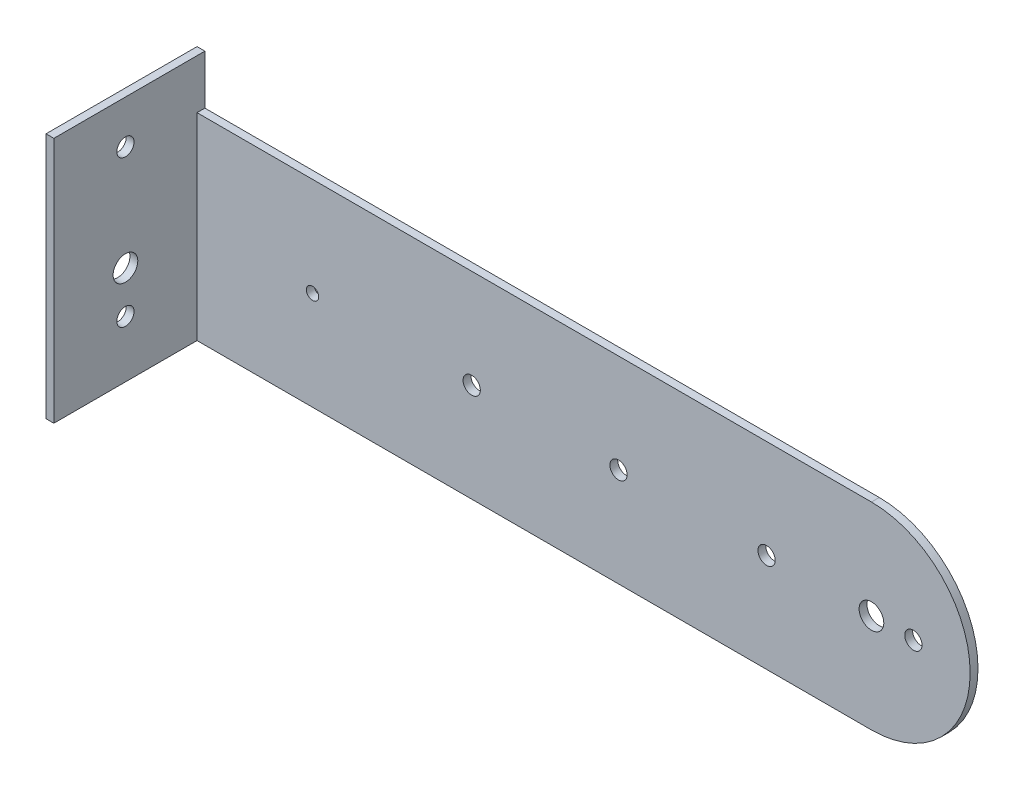
from build123d import *

# Parameters (mm, degrees)
BOSS_EXTRUDE1_DEPTH = 1.59
SKETCH2_R           = 2.5
SKETCH2_R_2         = 1.75
CUT_EXTRUDE2_DEPTH  = 1.59
SKETCH3_W           = 1.59
SKETCH3_H           = 40
BOSS_EXTRUDE2_DEPTH = 30.602
SKETCH5_W           = 1.59
SKETCH5_H           = 40
CUT_EXTRUDE4_DEPTH  = 10
SKETCH9_W           = 30.602
SKETCH9_H           = 10
BOSS_EXTRUDE4_DEPTH = 1.59
SKETCH10_R          = 1.75
SKETCH10_R_2        = 2.5
CUT_EXTRUDE6_DEPTH  = 10
SKETCH11_R          = 1.25
CUT_EXTRUDE7_DEPTH  = 10


with BuildPart() as part:
    # Sketch1 → Boss-Extrude1 (new body)
    with BuildSketch(Plane.XY):
        with BuildLine():
            Line((-38.514035237, 20), (38.514035237, 20))
            ThreePointArc((38.514035237, 20), (58.514035237, 0), (38.514035237, -20))
            Line((38.514035237, -20), (-38.514035237, -20))
            Line((-38.514035237, -20), (-99.729964763, -20))
            Line((-99.729964763, -20), (-99.729964763, 20))
            Line((-99.729964763, 20), (-38.514035237, 20))
        make_face()
    extrude(amount=BOSS_EXTRUDE1_DEPTH)

    # Sketch2 → Cut-Extrude2 (cut)
    with BuildSketch(Plane.XY.offset(1.59)):
        with Locations((38.514035237, 0)):
            Circle(SKETCH2_R)
        with Locations((47.014035237, 0)):
            Circle(SKETCH2_R_2)
        with Locations((17.264035237, 0)):
            Circle(SKETCH2_R_2)
        with Locations((-12.735964763, 0)):
            Circle(SKETCH2_R_2)
        with Locations((-42.485964763, 0)):
            Circle(SKETCH2_R_2)
    extrude(amount=-CUT_EXTRUDE2_DEPTH, mode=Mode.SUBTRACT)

    # Sketch3 → Boss-Extrude2 (add)
    with BuildSketch(Plane.XY.offset(1.59)):
        with Locations((-98.934964763, 0)):
            Rectangle(SKETCH3_W, SKETCH3_H)
    extrude(amount=BOSS_EXTRUDE2_DEPTH)

    # Sketch5 → Cut-Extrude4 (cut)
    with BuildSketch(Plane.ZY.offset(99.729964763)):
        with Locations((31.397, 0)):
            Rectangle(SKETCH5_W, SKETCH5_H)
    extrude(amount=-CUT_EXTRUDE4_DEPTH, mode=Mode.SUBTRACT)

    # Sketch9 → Boss-Extrude4 (add)
    with BuildSketch(Plane.ZY.offset(99.729964763)):
        with Locations((15.301, 25)):
            Rectangle(SKETCH9_W, SKETCH9_H)
    extrude(amount=-BOSS_EXTRUDE4_DEPTH)

    # Sketch10 → Cut-Extrude6 (cut)
    with BuildSketch(Plane.ZY.offset(99.729964763)):
        with Locations((16.096, -8.5)):
            Circle(SKETCH10_R)
        with Locations((16.096, 0)):
            Circle(SKETCH10_R_2)
        with Locations((16.096, 21.25)):
            Circle(SKETCH10_R)
    extrude(amount=-CUT_EXTRUDE6_DEPTH, mode=Mode.SUBTRACT)

    # Sketch11 → Cut-Extrude7 (cut)
    with BuildSketch(Plane.XY.offset(1.59)):
        with Locations((-74.729964763, 0)):
            Circle(SKETCH11_R)
    extrude(amount=-CUT_EXTRUDE7_DEPTH, mode=Mode.SUBTRACT)


solid = part.part
